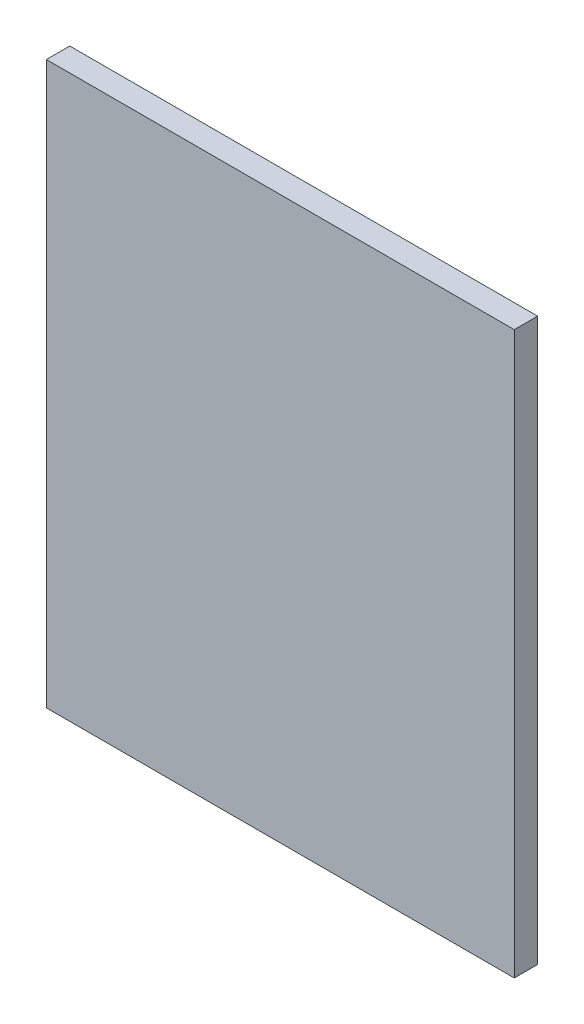
from build123d import *

# Parameters (mm, degrees)
SKETCH1_W           = 1000
SKETCH1_H           = 1200
BOSS_EXTRUDE1_DEPTH = 50


with BuildPart() as part:
    # Sketch1 → Boss-Extrude1 (new body)
    with BuildSketch(Plane.XY):
        with Locations((-264.383561644, -154.109589041)):
            Rectangle(SKETCH1_W, SKETCH1_H)
    extrude(amount=BOSS_EXTRUDE1_DEPTH)


solid = part.part
